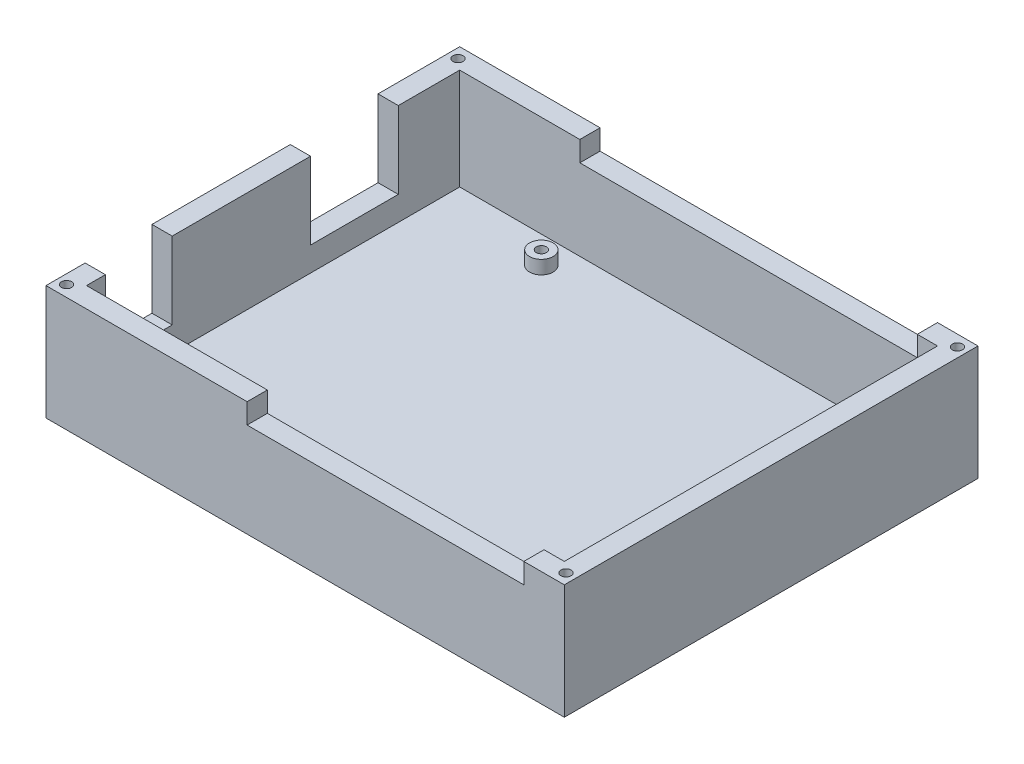
from build123d import *

# Parameters (mm, degrees)
SKETCH1_W           = 76.8
SKETCH1_H           = 61.3
BOSS_EXTRUDE1_DEPTH = 2
SKETCH2_W           = 76.8
SKETCH2_H           = 61.3
SKETCH2_W_2         = 70.8
SKETCH2_H_2         = 55.3
BOSS_EXTRUDE2_DEPTH = 15
CUT_EXTRUDE1_REACH  = 86.04
SKETCH6_W           = 13
SKETCH6_H           = 14.670742809
CUT_EXTRUDE2_REACH  = 86.04
SKETCH7_W           = 9.9
SKETCH7_H           = 11.743698963
CUT_EXTRUDE3_REACH  = 75.873
SKETCH8_W           = 41
SKETCH8_H           = 11.477298103
CUT_EXTRUDE4_REACH  = 75.873
SKETCH9_W           = 50
SKETCH9_H           = 13.6396876
SKETCH10_R          = 1.75
BOSS_EXTRUDE4_DEPTH = 2
SKETCH11_R          = 0.75
CUT_EXTRUDE5_DEPTH  = 2.5
SKETCH12_R          = 0.75
CUT_EXTRUDE6_DEPTH  = 2.5


with BuildPart() as part:
    # Sketch1 → Boss-Extrude1 (new body)
    with BuildSketch(Plane(origin=(0, 0, 0), x_dir=(1, 0, 0), z_dir=(0, 1, 0))):
        Rectangle(SKETCH1_W, SKETCH1_H)
    extrude(amount=-BOSS_EXTRUDE1_DEPTH)

    # Sketch2 → Boss-Extrude2 (add)
    with BuildSketch(Plane(origin=(0, 0, 0), x_dir=(1, 0, 0), z_dir=(0, 1, 0))):
        Rectangle(SKETCH2_W, SKETCH2_H)
        Rectangle(SKETCH2_W_2, SKETCH2_H_2, mode=Mode.SUBTRACT)
    extrude(amount=BOSS_EXTRUDE2_DEPTH)

    # Sketch6 → Cut-Extrude1 (cut, up to next)
    with BuildSketch(Plane.ZY.offset(38.4), mode=Mode.PRIVATE) as cut_extrude1_sk1:
        with Locations((-12.05, 10.935371405)):
            Rectangle(SKETCH6_W, SKETCH6_H)
    cut_extrude1_tool1 = extrude(cut_extrude1_sk1.sketch, amount=-CUT_EXTRUDE1_REACH, mode=Mode.PRIVATE) & part.part
    add(cut_extrude1_tool1.solids().sort_by_distance((-38.4, 10.935371, -12.05))[0], mode=Mode.SUBTRACT)

    # Sketch7 → Cut-Extrude2 (cut, up to next)
    with BuildSketch(Plane.ZY.offset(38.4), mode=Mode.PRIVATE) as cut_extrude2_sk1:
        with Locations((19.9, 9.471849482)):
            Rectangle(SKETCH7_W, SKETCH7_H)
    cut_extrude2_tool1 = extrude(cut_extrude2_sk1.sketch, amount=-CUT_EXTRUDE2_REACH, mode=Mode.PRIVATE) & part.part
    add(cut_extrude2_tool1.solids().sort_by_distance((-38.4, 9.471849, 19.9))[0], mode=Mode.SUBTRACT)

    # Sketch8 → Cut-Extrude3 (cut, up to next)
    with BuildSketch(Plane.XY.offset(30.65), mode=Mode.PRIVATE) as cut_extrude3_sk1:
        with Locations((11.9, 17.738649052)):
            Rectangle(SKETCH8_W, SKETCH8_H)
    cut_extrude3_tool1 = extrude(cut_extrude3_sk1.sketch, amount=-CUT_EXTRUDE3_REACH, mode=Mode.PRIVATE) & part.part
    add(cut_extrude3_tool1.solids().sort_by_distance((11.9, 17.738649, 30.65))[0], mode=Mode.SUBTRACT)

    # Sketch9 → Cut-Extrude4 (cut, up to next)
    with BuildSketch(Plane(origin=(0, 0, -30.65), x_dir=(-1, 0, 0), z_dir=(0, 0, -1)), mode=Mode.PRIVATE) as cut_extrude4_sk1:
        with Locations((-7.4, 18.8198438)):
            Rectangle(SKETCH9_W, SKETCH9_H)
    cut_extrude4_tool1 = extrude(cut_extrude4_sk1.sketch, amount=-CUT_EXTRUDE4_REACH, mode=Mode.PRIVATE) & part.part
    add(cut_extrude4_tool1.solids().sort_by_distance((7.4, 18.819844, -30.65))[0], mode=Mode.SUBTRACT)

    # Sketch10 → Boss-Extrude4 (add)
    with BuildSketch(Plane(origin=(0, 0, 0), x_dir=(1, 0, 0), z_dir=(0, 1, 0))):
        with Locations(Location((-19.3, 23.65, 0), (0, 0, 90))):
            Circle(SKETCH10_R)
        with Locations(Location((-20.4, -24.15, 0), (0, 0, 90))):
            Circle(SKETCH10_R)
        with Locations(Location((31.5, 8.45, 0), (0, 0, 90))):
            Circle(SKETCH10_R)
        with Locations(Location((31.5, -19.45, 0), (0, 0, 90))):
            Circle(SKETCH10_R)
    extrude(amount=BOSS_EXTRUDE4_DEPTH)

    # Sketch11 → Cut-Extrude5 (cut)
    with BuildSketch(Plane(origin=(0, 2, 0), x_dir=(1, 0, 0), z_dir=(0, 1, 0))):
        with Locations(Location((-19.3, 23.65, 0), (0, 0, 270))):
            Circle(SKETCH11_R)
        with Locations(Location((-20.4, -24.15, 0), (0, 0, 270))):
            Circle(SKETCH11_R)
        with Locations(Location((31.5, 8.45, 0), (0, 0, 270))):
            Circle(SKETCH11_R)
        with Locations(Location((31.5, -19.45, 0), (0, 0, 270))):
            Circle(SKETCH11_R)
    extrude(amount=-CUT_EXTRUDE5_DEPTH, mode=Mode.SUBTRACT)

    # Sketch12 → Cut-Extrude6 (cut)
    with BuildSketch(Plane(origin=(0, 15, 0), x_dir=(1, 0, 0), z_dir=(0, 1, 0))):
        with Locations(Location((-37, 29, 0), (0, 0, 270))):
            Circle(SKETCH12_R)
        with Locations(Location((37, 29, 0), (0, 0, 270))):
            Circle(SKETCH12_R)
        with Locations(Location((37, -29, 0), (0, 0, 270))):
            Circle(SKETCH12_R)
        with Locations(Location((-37, -29, 0), (0, 0, 270))):
            Circle(SKETCH12_R)
    extrude(amount=-CUT_EXTRUDE6_DEPTH, mode=Mode.SUBTRACT)


solid = part.part
